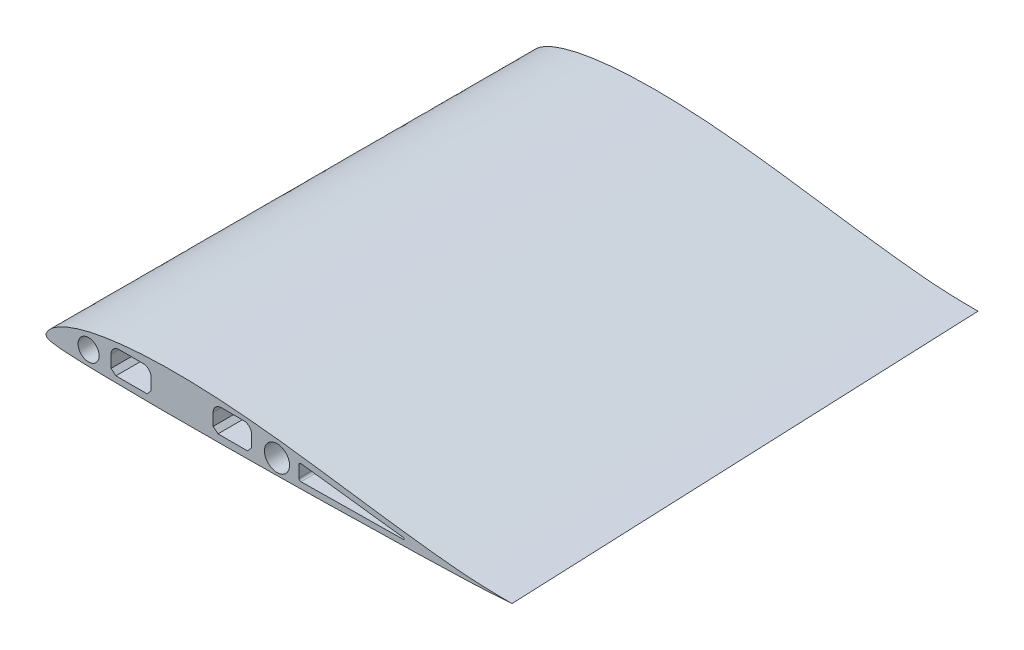
from build123d import *
from OCP.BRepFilletAPI import BRepFilletAPI_MakeChamfer

# Parameters (mm, degrees)
SKETCH4_R          = 2.6
SKETCH4_R_2        = 3.1
CUT_EXTRUDE1_DEPTH = 5.2
SKETCH5_W          = 9.9
SKETCH5_H          = 6
SKETCH5_W_2        = 9.5
CUT_EXTRUDE2_DEPTH = 82
FILLET3_R          = 2
CHAMFER1_SIZE      = 1
CHAMFER1_SIZE2     = 1.191753593
CUT_EXTRUDE3_DEPTH = 90.2
FILLET4_R          = 0.2
FILLET5_R          = 0.5


with BuildPart() as part:
    # Sketch1 → Loft1 section 0
    with BuildSketch(Plane.XY):
        with BuildLine():
            add(Edge.make_bspline(
                [(115, 0), (114.999913382, 0.00327866), (114.222934603, -0.004567066), (113.418136575, 0.000318408), (111.44543546, 0.018706002), (108.999380922, 0.080565277), (105.780115155, 0.203144323), (101.978037922, 0.467320429), (97.63148646, 0.880990765), (92.843812566, 1.427373326), (87.693014802, 2.062174327), (82.26127365, 2.794917392), (76.628898252, 3.582200475), (70.875421432, 4.408274793), (65.069516957, 5.204495648), (59.272555938, 5.964988559), (53.535411353, 6.612069385), (47.902032041, 7.147901639), (42.420677472, 7.538059951), (37.125743857, 7.784294524), (32.060080889, 7.863888962), (27.260899934, 7.799703202), (22.764274035, 7.585443948), (18.606628598, 7.224009749), (14.819582747, 6.717397261), (11.43119341, 6.102885155), (8.463318021, 5.359495242), (5.929953708, 4.523167874), (3.840235227, 3.611431652), (2.203139301, 2.680524392), (0.997143498, 1.719388226), (0.306055902, 0.84473605), (-0.153897847, -0.016785493), (0.441131195, -0.783771302), (1.630250645, -0.976182526), (3.345026164, -1.247099953), (5.741349663, -1.385446358), (8.741002332, -1.531007587), (12.32356917, -1.613427576), (16.426146399, -1.711956772), (20.996614723, -1.764001286), (25.979915364, -1.804105207), (31.316658928, -1.826220598), (36.950031377, -1.811871436), (42.810070502, -1.783755804), (48.833365319, -1.730024981), (54.950109545, -1.67348399), (61.093513049, -1.595166549), (67.193299365, -1.488121719), (73.176935484, -1.397778739), (78.980025922, -1.271232402), (84.533413271, -1.152999753), (89.776869938, -1.037364871), (94.647010434, -0.905039683), (99.089599698, -0.778312882), (103.055602703, -0.646322839), (106.488295637, -0.529569147), (109.391284428, -0.370730171), (111.629000068, -0.244208643), (113.467096811, -0.099576309), (114.237158295, -0.036931621), (115.000086752, -0.003283716), (115, 0)],
                knots=[0, 0, 0, 0, 0.001545172, 0.006223608, 0.014035782, 0.024855049, 0.038644124, 0.055163693, 0.074045466, 0.094820373, 0.117222732, 0.140866367, 0.165395395, 0.190452399, 0.215710088, 0.240854358, 0.265734023, 0.290048364, 0.313714428, 0.336486101, 0.358292895, 0.378940292, 0.398278007, 0.416246563, 0.432660408, 0.447459903, 0.460566131, 0.472021733, 0.481783695, 0.489844359, 0.496307136, 0.50126117, 0.504695153, 0.507385543, 0.512190444, 0.519692984, 0.529980259, 0.542956454, 0.558414131, 0.576101982, 0.595804604, 0.61726601, 0.64027206, 0.66452271, 0.689803764, 0.7157292, 0.742084221, 0.768568973, 0.794840399, 0.820639753, 0.845625339, 0.869581038, 0.892163588, 0.913159587, 0.932310678, 0.94940252, 0.964220925, 0.976641917, 0.986532119, 0.993892864, 0.998452446, 1, 1, 1, 1], degree=3))
        make_face()
    # Sketch2 → Loft1 section 1
    with BuildSketch(Plane.XY.offset(-120)):
        with BuildLine():
            add(Edge.make_bspline(
                [(110, 0), (110.000464145, 0.002638021), (109.253557002, -0.006421882), (108.485306247, 0.00202473), (106.599515685, 0.014018922), (104.259903283, 0.071192731), (101.178986874, 0.200889618), (97.542661477, 0.451950761), (93.384633146, 0.843539364), (88.805204424, 1.362015696), (83.880374164, 1.978555721), (78.68657223, 2.677523385), (73.299477431, 3.430735281), (67.795235431, 4.215247142), (62.241233075, 4.984660857), (56.695525551, 5.697469803), (51.207787306, 6.322755672), (45.821489693, 6.833626486), (40.577824462, 7.211562863), (35.514283248, 7.444282984), (30.668486135, 7.527509184), (26.076763803, 7.463490784), (21.77566696, 7.255221358), (17.798933432, 6.909184212), (14.177047879, 6.430194992), (10.935139134, 5.831964767), (8.094704102, 5.122344568), (5.670248347, 4.327180111), (3.669790047, 3.460558372), (2.10909167, 2.56151381), (0.952680778, 1.647952784), (0.292493833, 0.810328248), (-0.144477468, -0.013443729), (0.421457768, -0.751792674), (1.561430619, -0.927732015), (3.196411713, -1.199647616), (5.489901797, -1.325203312), (8.359384575, -1.457341268), (11.786506209, -1.55318322), (15.712038629, -1.632817261), (20.085890157, -1.693490267), (24.85332264, -1.730533844), (29.958495668, -1.745317698), (35.344133299, -1.736641885), (40.949025669, -1.70754651), (46.710109342, -1.660092686), (52.562107594, -1.595708584), (58.438334584, -1.519615465), (64.272360823, -1.429130605), (69.997133878, -1.329443239), (75.548112692, -1.222377083), (80.861507128, -1.10840335), (85.876724326, -0.990587124), (90.536246874, -0.869398239), (94.784781842, -0.746694986), (98.577741113, -0.621781265), (101.858350076, -0.496229968), (104.635869759, -0.366297292), (106.773720091, -0.224338993), (108.53252638, -0.099668194), (109.269457647, -0.031974616), (109.999539654, -0.002616432), (110, 0)],
                knots=[0, 0, 0, 0, 0.001564721, 0.006239121, 0.014018617, 0.024861007, 0.038659987, 0.055174427, 0.074046407, 0.094837256, 0.117226118, 0.14085626, 0.165386109, 0.19045125, 0.215702393, 0.240866612, 0.265718976, 0.290051983, 0.313696202, 0.33648442, 0.358279861, 0.378929437, 0.398292398, 0.416235766, 0.432650472, 0.447455618, 0.460592079, 0.472030369, 0.48177877, 0.489853088, 0.496315276, 0.501246195, 0.504684904, 0.507403743, 0.512183233, 0.519672773, 0.529968131, 0.54294809, 0.558399818, 0.576099165, 0.595810572, 0.617282889, 0.64027984, 0.664535393, 0.689783385, 0.715732831, 0.742092653, 0.768566703, 0.794844175, 0.820638712, 0.845644257, 0.86958445, 0.892182833, 0.913177877, 0.932327829, 0.949410904, 0.964230176, 0.976629486, 0.986536787, 0.993881551, 0.998448084, 1, 1, 1, 1], degree=3))
        make_face()
    loft()

    # Sketch4 → Cut-Extrude1 (cut)
    with BuildSketch(Plane.XY):
        with Locations((10.5, 2)):
            Circle(SKETCH4_R)
        with Locations((57, 2.1)):
            Circle(SKETCH4_R_2)
    extrude(amount=-CUT_EXTRUDE1_DEPTH, mode=Mode.SUBTRACT)

    # Sketch5 → Cut-Extrude2 (cut)
    with BuildSketch(Plane.XY):
        with Locations((21, 2.8)):
            Rectangle(SKETCH5_W, SKETCH5_H)
        with Locations((46, 3)):
            Rectangle(SKETCH5_W_2, SKETCH5_H)
    extrude(amount=-CUT_EXTRUDE2_DEPTH, mode=Mode.SUBTRACT)

    # Fillet3
    fillet3_edges = [part.edges().sort_by_distance(p)[0] for p in [
        (25.95, 5.8, -41),
        (16.05, 5.8, -41),
        (50.75, 6, -41),
        (41.25, 6, -41),
    ]]
    fillet(fillet3_edges, radius=FILLET3_R)

    # Chamfer1: one chamfer whose edges measure the first distance from different faces: ONE call of the kernel's chamfer builder (chamfer() names one face for all edges)
    chamfer1_edges_1 = [part.edges().sort_by_distance(p)[0] for p in [
        (25.95, -0.2, -41),
    ]]
    chamfer1_side_1 = [part.faces().sort_by_distance(p)[0] for p in [
        (21, -0.2, -41),
    ]]
    chamfer1_edges_2 = [part.edges().sort_by_distance(p)[0] for p in [
        (16.05, -0.2, -41),
    ]]
    chamfer1_side_2 = [part.faces().sort_by_distance(p)[0] for p in [
        (16.05, 1.8, -41),
    ]]
    chamfer1_edges_3 = [part.edges().sort_by_distance(p)[0] for p in [
        (50.75, 0, -41),
    ]]
    chamfer1_side_3 = [part.faces().sort_by_distance(p)[0] for p in [
        (46, 0, -41),
    ]]
    chamfer1_edges_4 = [part.edges().sort_by_distance(p)[0] for p in [
        (41.25, 0, -41),
    ]]
    chamfer1_side_4 = [part.faces().sort_by_distance(p)[0] for p in [
        (41.25, 2, -41),
    ]]
    chamfer1 = BRepFilletAPI_MakeChamfer(part.part.solid().wrapped)
    for e in chamfer1_edges_1:
        chamfer1.Add(CHAMFER1_SIZE, CHAMFER1_SIZE2, e.wrapped, chamfer1_side_1[0].wrapped)  # the first distance lies on this face
    for e in chamfer1_edges_2:
        chamfer1.Add(CHAMFER1_SIZE, CHAMFER1_SIZE2, e.wrapped, chamfer1_side_2[0].wrapped)  # the first distance lies on this face
    for e in chamfer1_edges_3:
        chamfer1.Add(CHAMFER1_SIZE, CHAMFER1_SIZE2, e.wrapped, chamfer1_side_3[0].wrapped)  # the first distance lies on this face
    for e in chamfer1_edges_4:
        chamfer1.Add(CHAMFER1_SIZE, CHAMFER1_SIZE2, e.wrapped, chamfer1_side_4[0].wrapped)  # the first distance lies on this face
    add(Compound.cast(chamfer1.Shape()), mode=Mode.REPLACE)

    # Sketch6 → Cut-Extrude3 (cut)
    with BuildSketch(Plane.XY):
        Polygon((62.411905862, 3.940649629), (62.411905862, 0), (91.123097262, 0.343480777), align=None)
    extrude(amount=-CUT_EXTRUDE3_DEPTH, mode=Mode.SUBTRACT)

    # Fillet4
    fillet4_edges = [part.edges().sort_by_distance(p)[0] for p in [
        (91.123097262, 0.343480777, -45.1),
    ]]
    fillet(fillet4_edges, radius=FILLET4_R)

    # Fillet5
    fillet5_edges = [part.edges().sort_by_distance(p)[0] for p in [
        (62.411905862, 0, -45.1),
        (62.411905862, 3.940649629, -45.1),
    ]]
    fillet(fillet5_edges, radius=FILLET5_R)


solid = part.part
